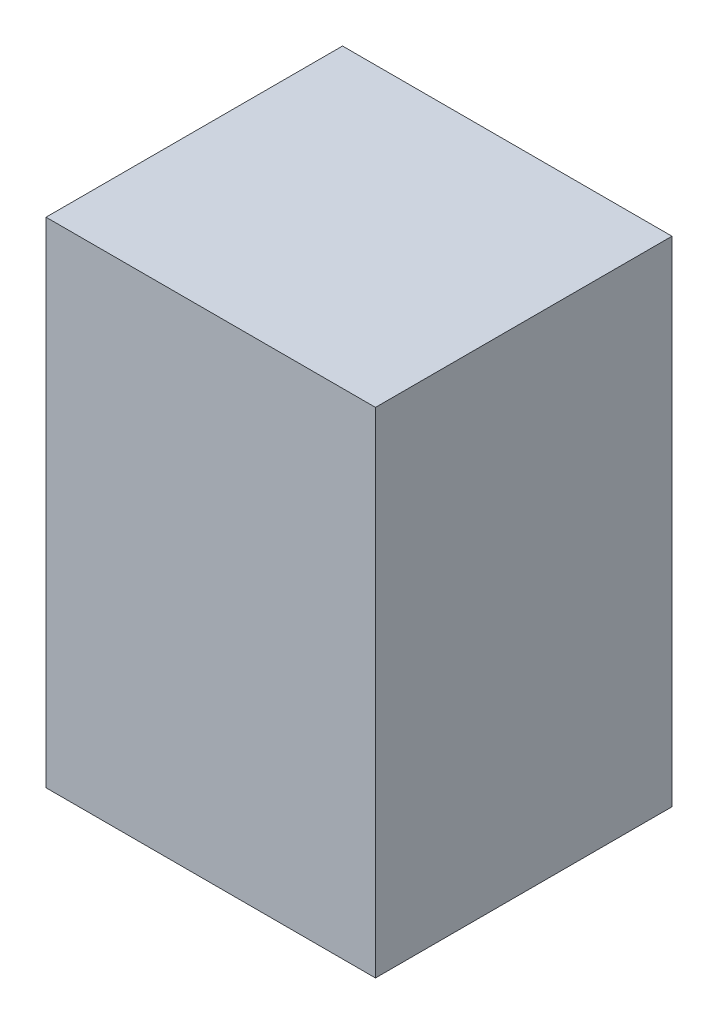
from build123d import *

# Parameters (mm, degrees)
SKETCH1_W           = 200
SKETCH1_H           = 180
BOSS_EXTRUDE1_DEPTH = 300


with BuildPart() as part:
    # Sketch1 → Boss-Extrude1 (new body)
    with BuildSketch(Plane(origin=(0, 0, 0), x_dir=(1, 0, 0), z_dir=(0, 1, 0))):
        Rectangle(SKETCH1_W, SKETCH1_H)
    extrude(amount=BOSS_EXTRUDE1_DEPTH)


solid = part.part
